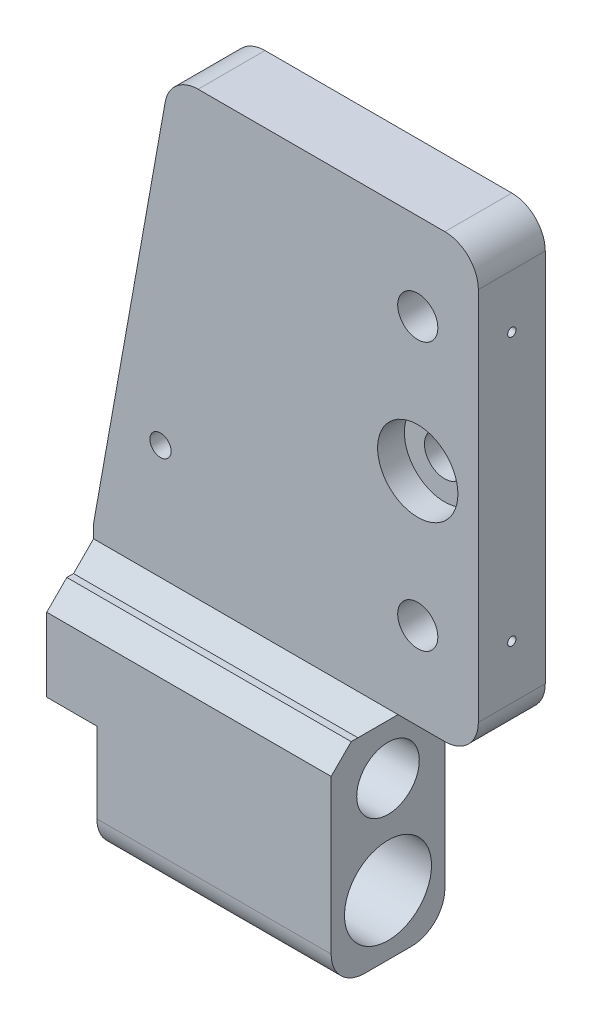
from build123d import *

# Parameters (mm, degrees)
SKETCH1_R             = 6
BOSS_EXTRUDE1_DEPTH   = 34
SKETCH2_W             = 115
SKETCH2_H             = 138
CUT_EXTRUDE1_DEPTH    = 14
SKETCH3_R             = 12
CUT_EXTRUDE2_DEPTH    = 8
SKETCH4_R             = 6
CUT_EXTRUDE3_DEPTH    = 225.686448189
FILLET1_R             = 10
CHAMFER1_SIZE         = 6
CUT_EXTRUDE8_DEPTH    = 34
SKETCH11_R            = 11.5
CUT_EXTRUDE9_DEPTH    = 6
SKETCH12_R            = 7
CUT_EXTRUDE10_DEPTH   = 224.588908491
FILLET3_R             = 10
SKETCH13_R            = 1.5
CUT_EXTRUDE11_DEPTH   = 224.588908491
M3_TAPPED_HOLE1_D     = 2.5
M3_TAPPED_HOLE1_DEPTH = 20
M3_TAPPED_HOLE1_TIP   = 0.751075774
SKETCH17_R            = 9.349207245
CUT_EXTRUDE12_DEPTH   = 234.197341372
SKETCH18_R            = 3.175
CUT_EXTRUDE13_DEPTH   = 20


with BuildPart() as part:
    # Sketch1 → Boss-Extrude1 (new body)
    with BuildSketch(Plane.XY):
        Polygon((0, 0), (70, 0), (70, 62), (76, 68), (100, 68), (100, 200), (7.876898591, 200), (-15, 72), (-15, 34), (0, 34), align=None)
        with Locations((81.891070834, 174)):
            Circle(SKETCH1_R, mode=Mode.SUBTRACT)
        with Locations((81.891070834, 94)):
            Circle(SKETCH1_R, mode=Mode.SUBTRACT)
    extrude(amount=BOSS_EXTRUDE1_DEPTH)

    # Sketch2 → Cut-Extrude1 (cut)
    with BuildSketch(Plane.XY.offset(34)):
        with Locations((42.5, 131)):
            Rectangle(SKETCH2_W, SKETCH2_H)
    extrude(amount=-CUT_EXTRUDE1_DEPTH, mode=Mode.SUBTRACT)

    # Sketch3 → Cut-Extrude2 (cut)
    with BuildSketch(Plane.XY.offset(20)):
        with Locations((81.891070834, 134)):
            Circle(SKETCH3_R)
    extrude(amount=-CUT_EXTRUDE2_DEPTH, mode=Mode.SUBTRACT)

    # Sketch4 → Cut-Extrude3 (cut, through all)
    with BuildSketch(Plane.XY.offset(12)):
        with Locations((81.891070834, 134)):
            Circle(SKETCH4_R)
    extrude(amount=-CUT_EXTRUDE3_DEPTH, mode=Mode.SUBTRACT)

    # Fillet1
    fillet1_edges = [part.edges().sort_by_distance(p)[0] for p in [
        (7.876898591, 200, 10),
        (100, 200, 10),
        (100, 68, 10),
    ]]
    fillet(fillet1_edges, radius=FILLET1_R)

    # Chamfer1
    chamfer1_edges = [part.edges().sort_by_distance(p)[0] for p in [
        (27.5, 62, 34),
        (27.5, 62, 20),
    ]]
    chamfer(chamfer1_edges, length=CHAMFER1_SIZE)

    # Sketch6 → Cut-Extrude8 (cut)
    with BuildSketch(Plane(origin=(70, 0, 0), x_dir=(0, 0, -1), z_dir=(1, 0, 0))):
        with BuildLine():
            ThreePointArc((-17, 31), (-30, 18), (-17, 5))
            Line((-17, 5), (-17, 31))
        make_face()
        with BuildLine():
            Line((-17, 31), (-17, 5))
            ThreePointArc((-17, 5), (-7.807611845, 8.807611845), (-4, 18))
            ThreePointArc((-4, 18), (-7.807611845, 27.192388155), (-17, 31))
        make_face()
    extrude(amount=-CUT_EXTRUDE8_DEPTH, mode=Mode.SUBTRACT)

    # Sketch11 → Cut-Extrude9 (cut)
    with BuildSketch(Plane.ZY):
        with Locations(Location((17, 18, 0), (0, 0, 270))):
            Circle(SKETCH11_R)
    extrude(amount=-CUT_EXTRUDE9_DEPTH, mode=Mode.SUBTRACT)

    # Sketch12 → Cut-Extrude10 (cut, through all)
    with BuildSketch(Plane.ZY.offset(-6)):
        with Locations(Location((17, 18, 0), (0, 0, 270))):
            Circle(SKETCH12_R)
    extrude(amount=-CUT_EXTRUDE10_DEPTH, mode=Mode.SUBTRACT)

    # Fillet3
    fillet3_edges = [part.edges().sort_by_distance(p)[0] for p in [
        (35, 0, 0),
        (35, 0, 34),
    ]]
    fillet(fillet3_edges, radius=FILLET3_R)

    # Sketch13 → Cut-Extrude11 (cut, through all)
    with BuildSketch(Plane.ZY.offset(-6)):
        with Locations((17, 26)):
            Circle(SKETCH13_R)
        with Locations((25, 18)):
            Circle(SKETCH13_R)
        with Locations((17, 10)):
            Circle(SKETCH13_R)
        with Locations((9, 18)):
            Circle(SKETCH13_R)
    extrude(amount=-CUT_EXTRUDE11_DEPTH, mode=Mode.SUBTRACT)

    # M3 Tapped Hole1
    with Locations(Plane(origin=(100, 0, 0), x_dir=(0, 0, -1), z_dir=(1, 0, 0))):
        with Locations((-10, 174), (-10, 94)):
            Hole(M3_TAPPED_HOLE1_D / 2, depth=M3_TAPPED_HOLE1_DEPTH)
            with Locations((0, 0, -(M3_TAPPED_HOLE1_DEPTH + M3_TAPPED_HOLE1_TIP / 2))):  # 118° drill point
                Cone(0, M3_TAPPED_HOLE1_D / 2, M3_TAPPED_HOLE1_TIP, mode=Mode.SUBTRACT)

    # Sketch17 → Cut-Extrude12 (cut, through all)
    with BuildSketch(Plane.ZY.offset(15)):
        with Locations(Location((17, 47, 0), (0, 0, 270))):
            Circle(SKETCH17_R)
    extrude(amount=-CUT_EXTRUDE12_DEPTH, mode=Mode.SUBTRACT)

    # Sketch18 → Cut-Extrude13 (cut)
    with BuildSketch(Plane(origin=(0, 0, 0), x_dir=(-1, 0, 0), z_dir=(0, 0, -1))):
        with Locations((-5, 102.220957779)):
            Circle(SKETCH18_R)
    extrude(amount=-CUT_EXTRUDE13_DEPTH, mode=Mode.SUBTRACT)


solid = part.part
